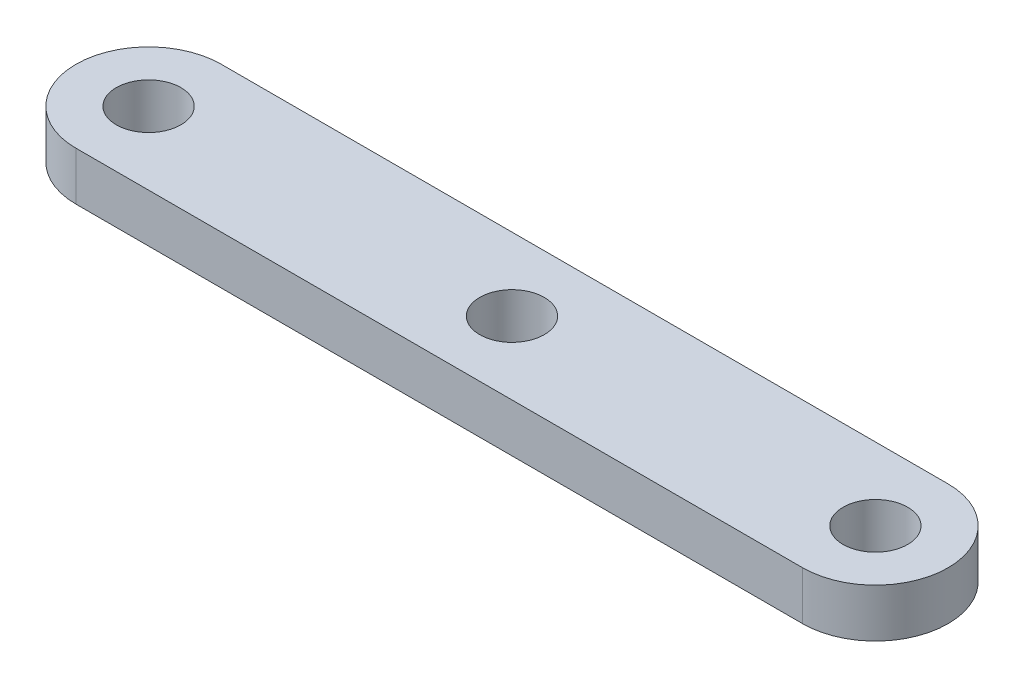
from build123d import *

# Parameters (mm, degrees)
BOSS_EXTRUDE1_DEPTH = 6
SKETCH3_R           = 4
CUT_EXTRUDE1_DEPTH  = 6


with BuildPart() as part:
    # Sketch2 → Boss-Extrude1 (new body)
    with BuildSketch(Plane(origin=(0, 0, 0), x_dir=(1, 0, 0), z_dir=(0, 1, 0))):
        with BuildLine():
            Line((0, 0), (90, 0))
            ThreePointArc((90, 0), (99, 9), (90, 18))
            Line((90, 18), (0, 18))
            ThreePointArc((0, 18), (-9, 9), (0, 0))
        make_face()
    extrude(amount=BOSS_EXTRUDE1_DEPTH)

    # Sketch3 → Cut-Extrude1 (cut)
    with BuildSketch(Plane.XZ):
        with Locations(Location((0, -9, 0), (0, 0, 270))):
            Circle(SKETCH3_R)
        with Locations(Location((90, -9, 0), (0, 0, 90))):
            Circle(SKETCH3_R)
        with Locations(Location((45, -9, 0), (0, 0, 270))):
            Circle(SKETCH3_R)
    extrude(amount=-CUT_EXTRUDE1_DEPTH, mode=Mode.SUBTRACT)


solid = part.part
